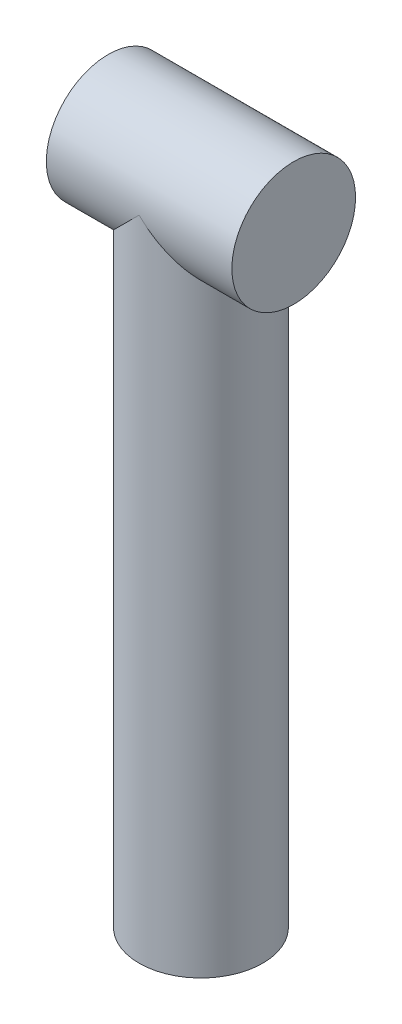
from build123d import *

# Parameters (mm, degrees)
SKETCH_1_R      = 20
EXTRUDE_1_DEPTH = 209.5
SKETCH_2_R      = 20
EXTRUDE_2_DEPTH = 30


with BuildPart() as part:
    # 草图1 → 凸台-拉伸1 (new body)
    with BuildSketch(Plane(origin=(0, 0, 0), x_dir=(1, 0, 0), z_dir=(0, 1, 0))):
        with Locations(Location((0, 0, 0), (0, 0, 270))):
            Circle(SKETCH_1_R)
    extrude(amount=EXTRUDE_1_DEPTH)

    # 草图2 → 凸台-拉伸2 (add, symmetric)
    with BuildSketch(Plane(origin=(0, 0, 0), x_dir=(0, 0, -1), z_dir=(1, 0, 0))):
        with Locations((0, 209.5)):
            Circle(SKETCH_2_R)
    extrude(amount=EXTRUDE_2_DEPTH, both=True)


solid = part.part
